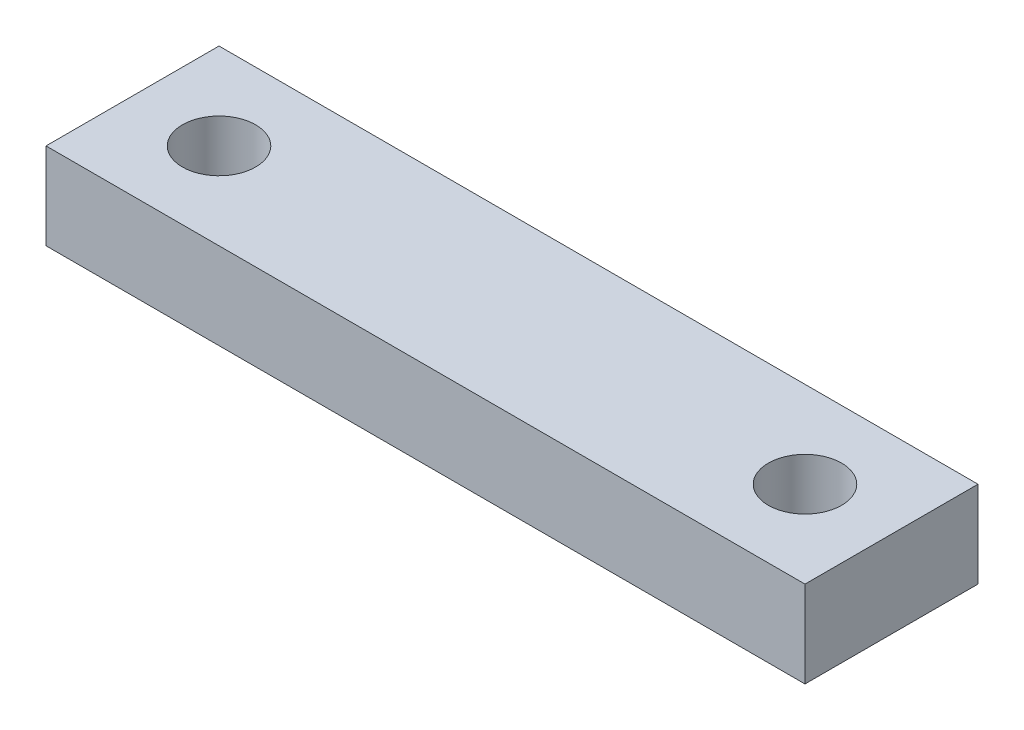
from build123d import *

# Parameters (mm, degrees)
SKETCH1_W           = 263.2
SKETCH1_H           = 30
BOSS_EXTRUDE1_DEPTH = 60
SKETCH2_R           = 12.7
CUT_EXTRUDE1_DEPTH  = 226.425867163


with BuildPart() as part:
    # Sketch1 → Boss-Extrude1 (new body)
    with BuildSketch(Plane.XY):
        with Locations((-83.613432634, 5.141150982)):
            Rectangle(SKETCH1_W, SKETCH1_H)
    extrude(amount=BOSS_EXTRUDE1_DEPTH)

    # Sketch2 → Cut-Extrude1 (cut, through all)
    with BuildSketch(Plane(origin=(0, 20.141150982, 0), x_dir=(1, 0, 0), z_dir=(0, 1, 0))):
        with Locations(Location((17.986567366, -30, 0), (0, 0, 270))):
            Circle(SKETCH2_R)
        with Locations(Location((-185.213432634, -30, 0), (0, 0, 270))):
            Circle(SKETCH2_R)
    extrude(amount=-CUT_EXTRUDE1_DEPTH, mode=Mode.SUBTRACT)


solid = part.part
